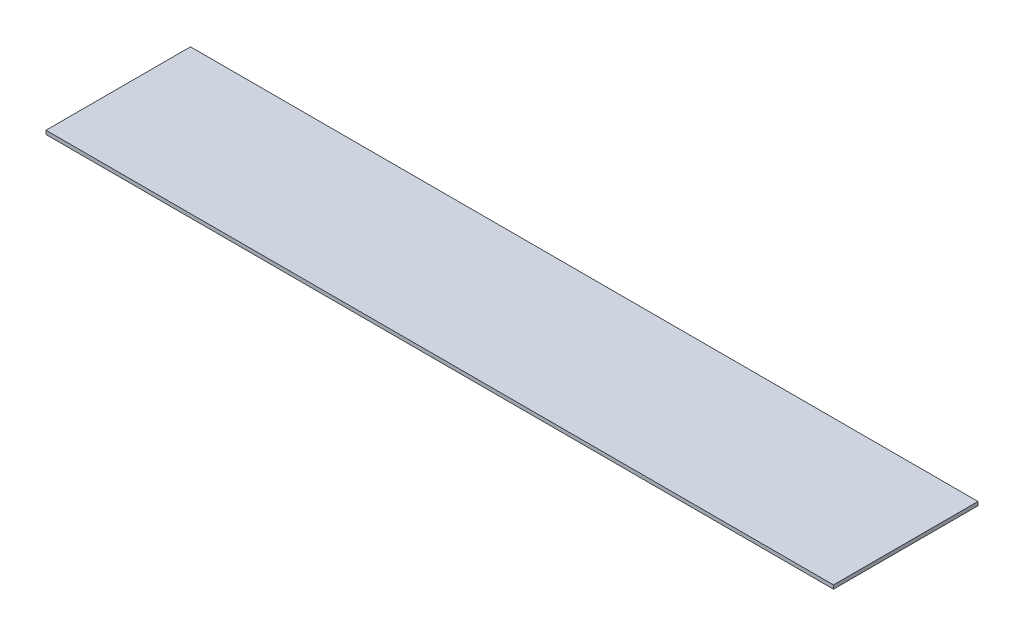
from build123d import *

# Parameters (mm, degrees)
SKETCH1_W           = 1007.121938
SKETCH1_H           = 184.792366
BOSS_EXTRUDE2_DEPTH = 4.7625


with BuildPart() as part:
    # Sketch1 → Boss-Extrude2 (new body)
    with BuildSketch(Plane(origin=(0, 0, 0), x_dir=(1, 0, 0), z_dir=(0, 1, 0))):
        with Locations((444.432020813, 63.995664579)):
            Rectangle(SKETCH1_W, SKETCH1_H)
    extrude(amount=BOSS_EXTRUDE2_DEPTH)


solid = part.part
